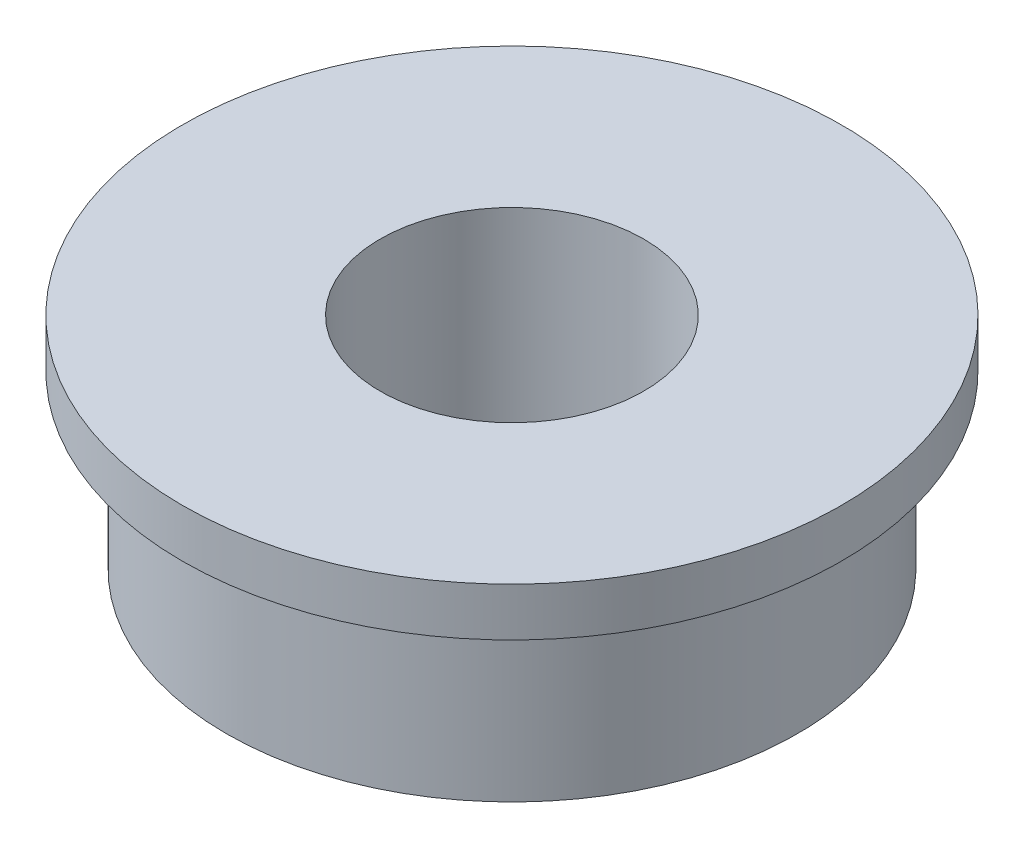
from build123d import *

# Parameters (mm, degrees)
SKETCH_1_R          = 6.5
EXTRUDE_1_DEPTH     = 2.5
SKETCH_2_R          = 7.5
EXTRUDE_3_DEPTH     = 1.1
SKETCH_6_R          = 3
CUT_EXTRUDE_3_DEPTH = 12.7260394


with BuildPart() as part:
    # ｽｹｯﾁ1 → ﾎﾞｽ - 押し出し1 (new, symmetric)
    with BuildSketch(Plane(origin=(0, 0, 0), x_dir=(1, 0, 0), z_dir=(0, 1, 0))):
        with Locations(Location((0, 0, 0), (0, 0, 270))):
            Circle(SKETCH_1_R)
    extrude(amount=EXTRUDE_1_DEPTH, both=True)

    # ｽｹｯﾁ2 → ﾎﾞｽ - 押し出し3 (add)
    with BuildSketch(Plane(origin=(0, 2.5, 0), x_dir=(1, 0, 0), z_dir=(0, 1, 0))):
        with Locations(Location((0, 0, 0), (0, 0, 270))):
            Circle(SKETCH_2_R)
    extrude(amount=-EXTRUDE_3_DEPTH)

    # ｽｹｯﾁ6 → ｶｯﾄ - 押し出し3 (cut, through all)
    with BuildSketch(Plane.XZ.offset(2.5)):
        with Locations(Location((0, 0, 0), (0, 0, 270))):
            Circle(SKETCH_6_R)
    extrude(amount=-CUT_EXTRUDE_3_DEPTH, mode=Mode.SUBTRACT)


solid = part.part
